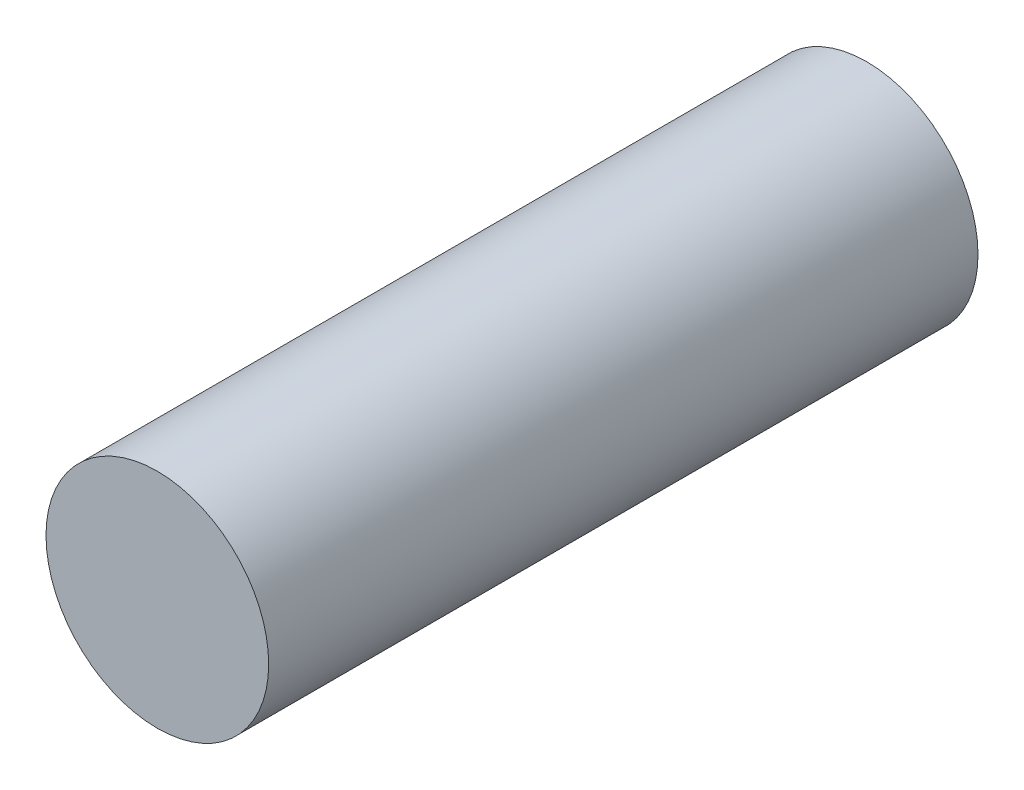
from build123d import *

# Parameters (mm, degrees)
SKETCH1_R           = 15.947656379
BOSS_EXTRUDE1_DEPTH = 101.6


with BuildPart() as part:
    # Sketch1 → Boss-Extrude1 (new body)
    with BuildSketch(Plane.XY):
        with Locations((12.011677439, -12.490352144)):
            Circle(SKETCH1_R)
    extrude(amount=BOSS_EXTRUDE1_DEPTH)


solid = part.part
